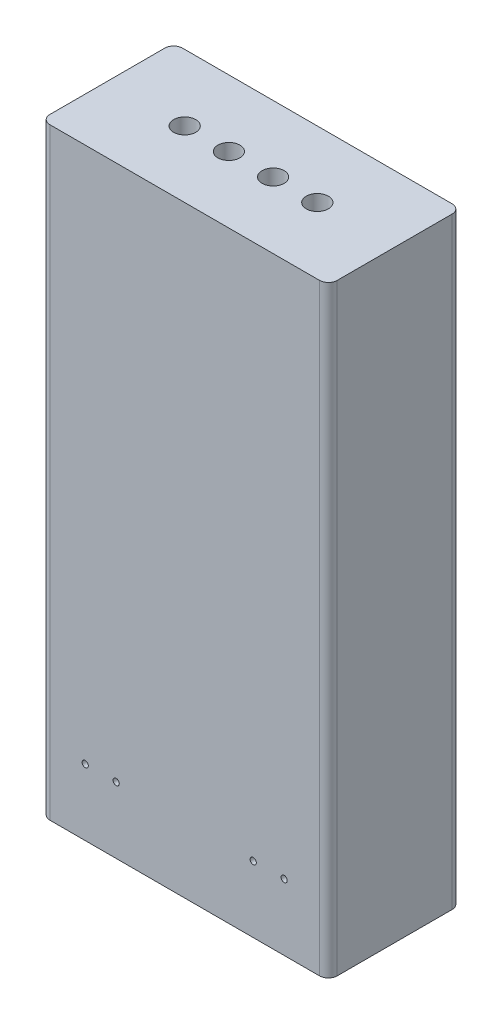
from build123d import *

# Parameters (mm, degrees)
SKETCH1_W           = 82.55
SKETCH1_H           = 173.0375
BOSS_EXTRUDE1_DEPTH = 19.05
SKETCH2_R           = 0.889
CUT_EXTRUDE1_DEPTH  = 104.153912803
FILLET1_R           = 2.54
SKETCH3_R           = 3.175
CUT_EXTRUDE2_DEPTH  = 50.8


with BuildPart() as part:
    # Sketch1 → Boss-Extrude1 (new, symmetric)
    with BuildSketch(Plane.XY):
        Rectangle(SKETCH1_W, SKETCH1_H)
    extrude(amount=BOSS_EXTRUDE1_DEPTH, both=True)

    # Sketch2 → Cut-Extrude1 (cut, through all)
    with BuildSketch(Plane.XY.offset(19.05)):
        with Locations((-28.575, -67.46875)):
            Circle(SKETCH2_R)
        with Locations((-19.685, -67.46875)):
            Circle(SKETCH2_R)
        with Locations((28.575, -67.46875)):
            Circle(SKETCH2_R)
        with Locations((19.685, -67.46875)):
            Circle(SKETCH2_R)
    extrude(amount=-CUT_EXTRUDE1_DEPTH, mode=Mode.SUBTRACT)

    # Fillet1
    fillet1_edges = [part.edges().sort_by_distance(p)[0] for p in [
        (-41.275, 0, 19.05),
        (41.275, 0, 19.05),
        (-41.275, 0, -19.05),
        (41.275, 0, -19.05),
    ]]
    fillet(fillet1_edges, radius=FILLET1_R)

    # Sketch3 → Cut-Extrude2 (cut)
    with BuildSketch(Plane(origin=(0, 86.51875, 0), x_dir=(1, 0, 0), z_dir=(0, 1, 0))):
        with Locations(Location((19.05, 0, 0), (0, 0, 270))):
            Circle(SKETCH3_R)
        with Locations(Location((-19.05, 0, 0), (0, 0, 270))):
            Circle(SKETCH3_R)
        with Locations(Location((-6.35, 0, 0), (0, 0, 270))):
            Circle(SKETCH3_R)
        with Locations(Location((6.35, 0, 0), (0, 0, 270))):
            Circle(SKETCH3_R)
    extrude(amount=-CUT_EXTRUDE2_DEPTH, mode=Mode.SUBTRACT)


solid = part.part
